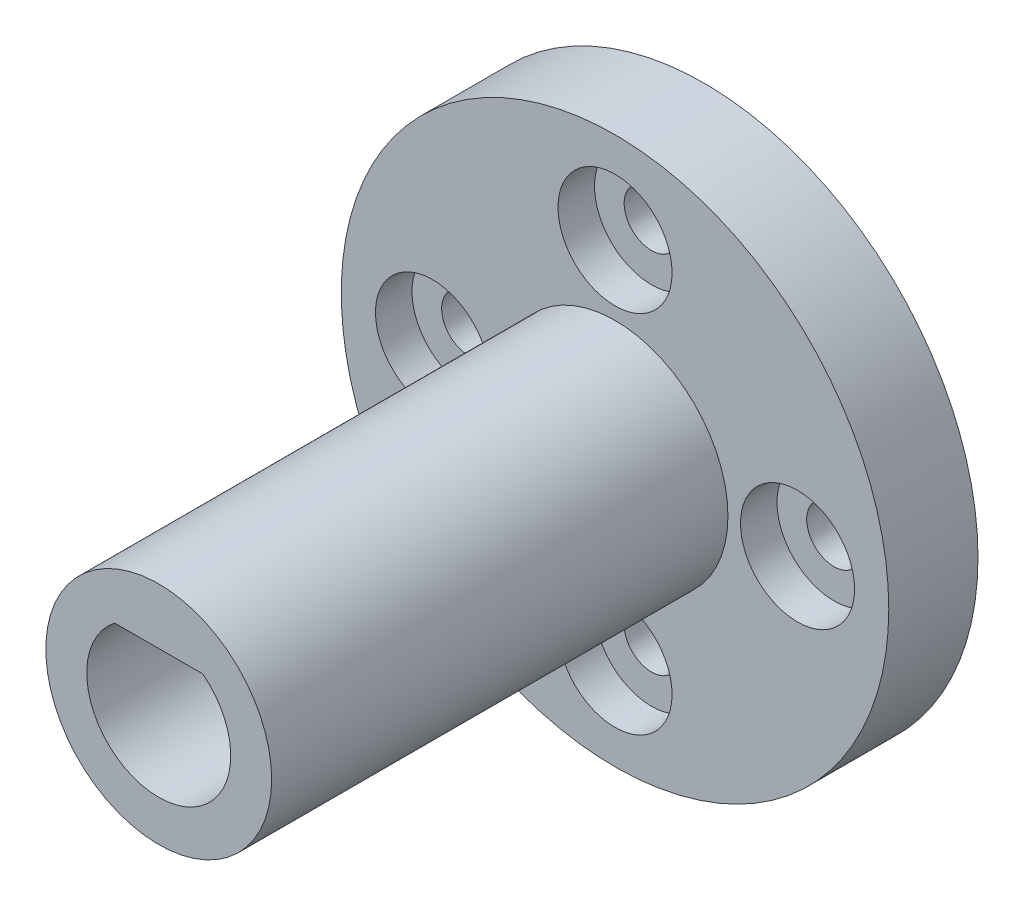
from build123d import *

# Parameters (mm, degrees)
ESQUISSE1_R                                        = 12
BOSS_EXTRU_1_DEPTH                                 = 3.91
ESQUISSE6_R                                        = 4
ENL_V_MAT_EXTRU_2_DEPTH                            = 1.91
ESQUISSE7_R                                        = 4.95
BOSS_EXTRU_2_DEPTH                                 = 20
CHAMBRAGE_POUR_VIS_T_TE_RONDE_BOMB_E_M_D           = 2.4
CHAMBRAGE_POUR_VIS_T_TE_RONDE_BOMB_E_M_CBORE_D     = 5
CHAMBRAGE_POUR_VIS_T_TE_RONDE_BOMB_E_M_CBORE_DEPTH = 1.6
R_P_TITION_CIRCULAIRE2_COUNT                       = 4


with BuildPart() as part:
    # Esquisse1 → Boss.-Extru.1 (new body)
    with BuildSketch(Plane.XY):
        Circle(ESQUISSE1_R)
    extrude(amount=BOSS_EXTRU_1_DEPTH)

    # Esquisse6 → Enlèv. mat.-Extru.2 (cut)
    with BuildSketch(Plane(origin=(0, 0, 0), x_dir=(-1, 0, 0), z_dir=(0, 0, -1))):
        Circle(ESQUISSE6_R)
    extrude(amount=-ENL_V_MAT_EXTRU_2_DEPTH, mode=Mode.SUBTRACT)

    # Esquisse7 → Boss.-Extru.2 (add)
    with BuildSketch(Plane.XY.offset(3.91)):
        Circle(ESQUISSE7_R)
        with BuildLine():
            Line((1.931061884, 2.495), (-1.931061884, 2.495))
            ThreePointArc((-1.931061884, 2.495), (0, -3.155), (1.931061884, 2.495))
        make_face(mode=Mode.SUBTRACT)
    extrude(amount=BOSS_EXTRU_2_DEPTH)

    # Chambrage pour vis à tête ronde bombée M21 (through all)
    with Locations(Plane.XY.offset(3.91)):
        with Locations((0, 8)):
            chambrage_pour_vis_t_te_ronde_bomb_e_m = CounterBoreHole(CHAMBRAGE_POUR_VIS_T_TE_RONDE_BOMB_E_M_D / 2, CHAMBRAGE_POUR_VIS_T_TE_RONDE_BOMB_E_M_CBORE_D / 2, CHAMBRAGE_POUR_VIS_T_TE_RONDE_BOMB_E_M_CBORE_DEPTH)

    # Répétition circulaire2: Chambrage pour vis à tête ronde bombée M21 ×4 about axis
    r_p_tition_circulaire2_axis = Axis((0, 0, 0), (0, 0, 1))
    for i in range(1, R_P_TITION_CIRCULAIRE2_COUNT):
        add(chambrage_pour_vis_t_te_ronde_bomb_e_m.rotate(r_p_tition_circulaire2_axis, i * 360 / R_P_TITION_CIRCULAIRE2_COUNT), mode=Mode.SUBTRACT)


solid = part.part
